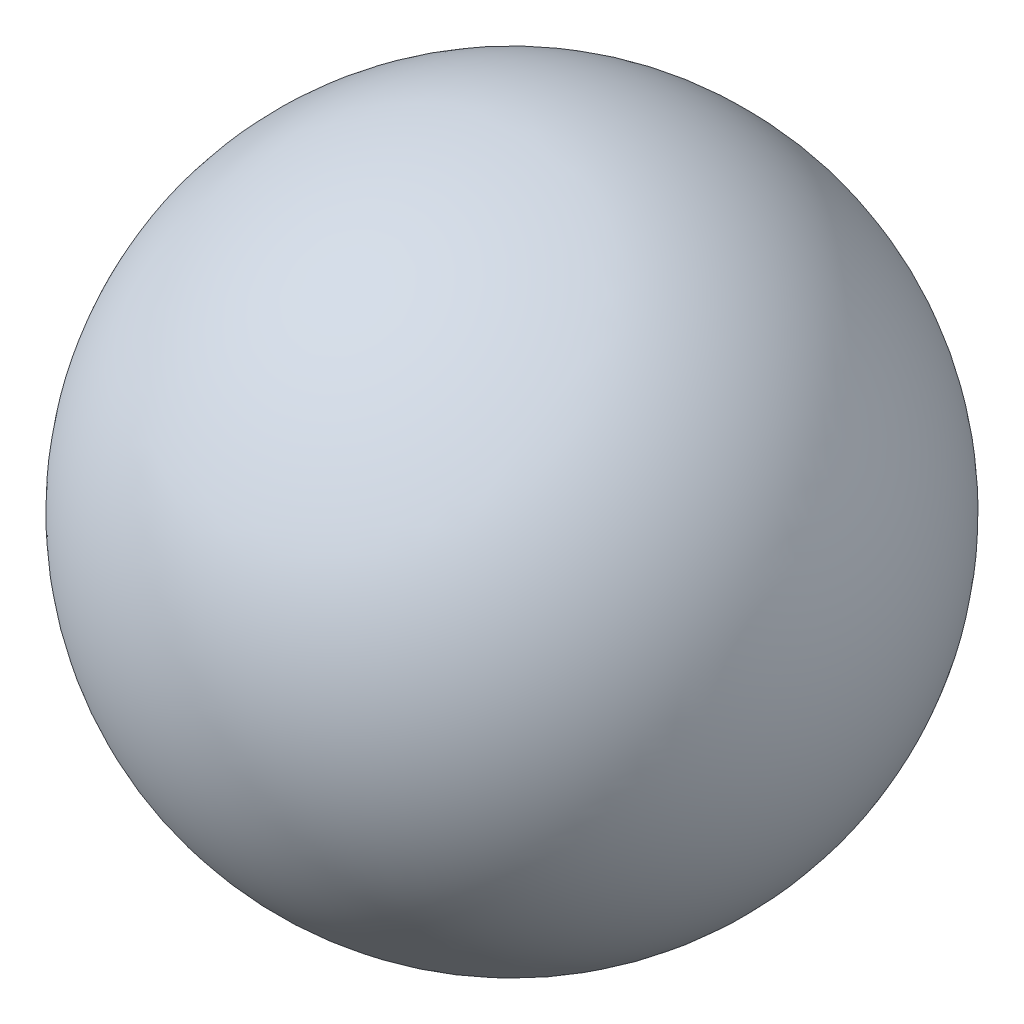
from build123d import *


with BuildPart() as part:
    # Sketch1 → Revolve1 (revolve)
    with BuildSketch(Plane.XY):
        with BuildLine():
            Line((-30.115625553, 0), (30.115625553, 0))
            ThreePointArc((30.115625553, 0), (0, 30.115625553), (-30.115625553, 0))
        make_face()
    revolve(axis=Axis((-30.115625553, 0, 0), (1, 0, 0)))


solid = part.part
